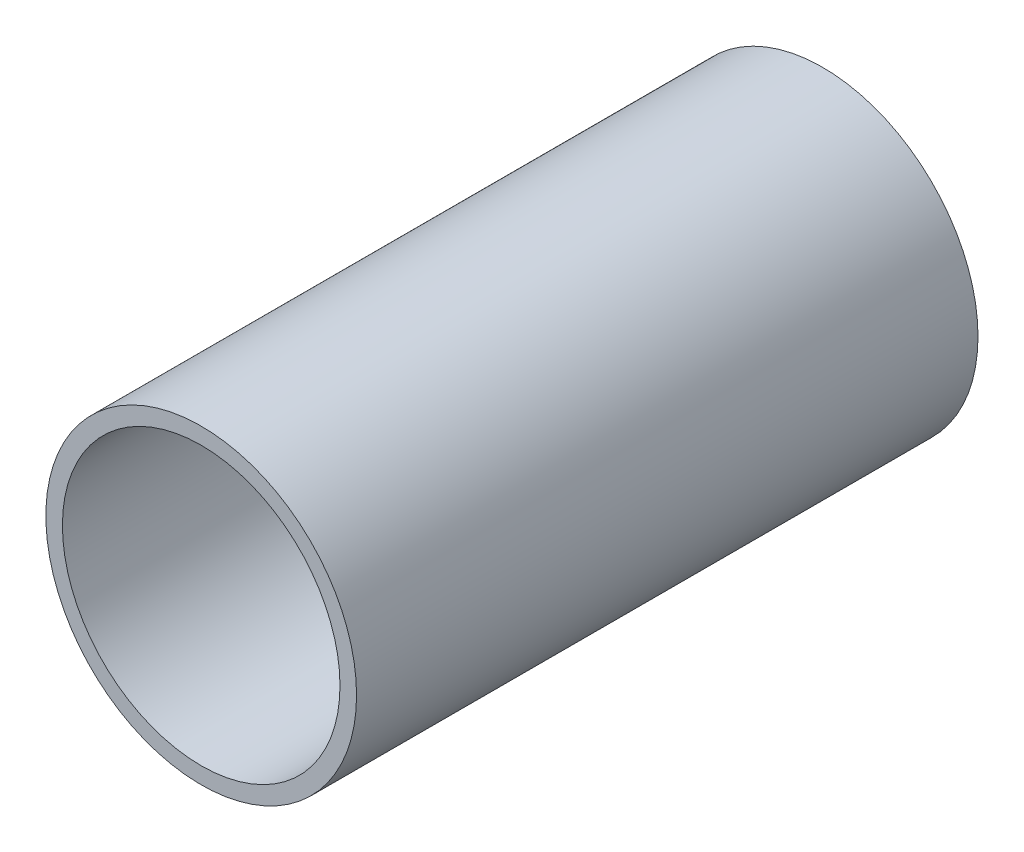
from build123d import *

# Parameters (mm, degrees)
SKETCH1_R           = 15
SKETCH1_R_2         = 13.4
BOSS_EXTRUDE1_DEPTH = 60


with BuildPart() as part:
    # Sketch1 → Boss-Extrude1 (new body)
    with BuildSketch(Plane.XY):
        Circle(SKETCH1_R)
        Circle(SKETCH1_R_2, mode=Mode.SUBTRACT)
    extrude(amount=BOSS_EXTRUDE1_DEPTH)


solid = part.part
